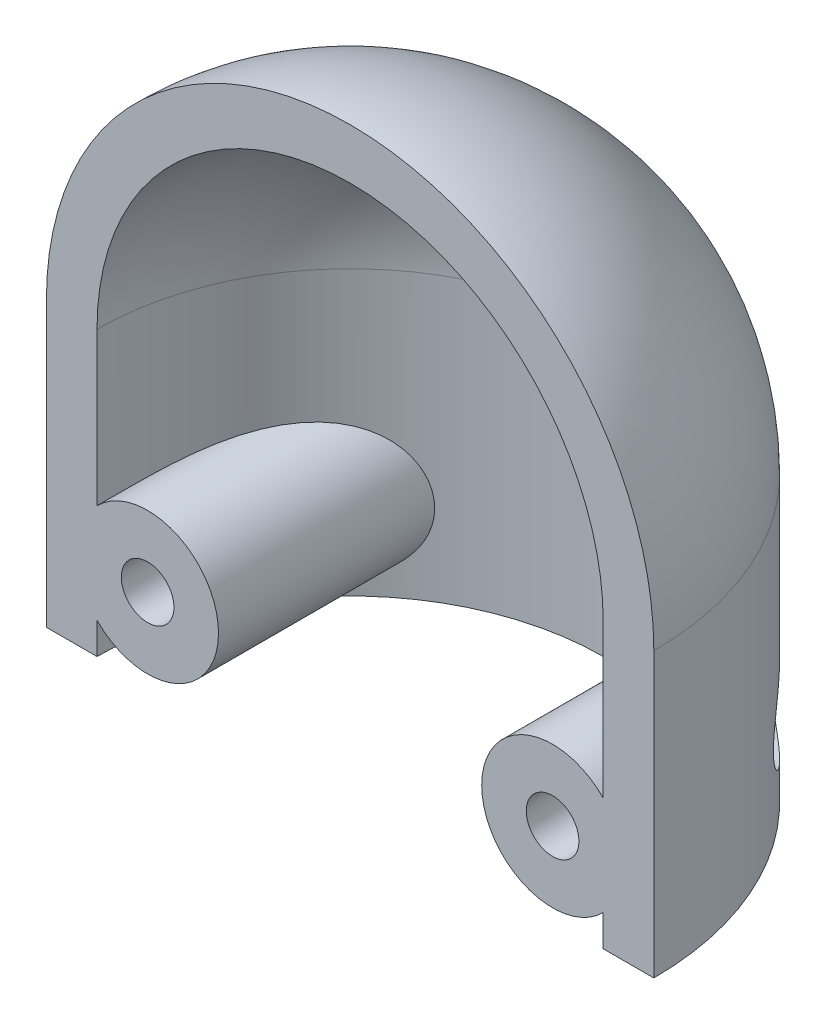
from build123d import *

# Parameters (mm, degrees)
ROTATION1_ANGLE                 = 180
AUFSATZ_LINEAR_AUSTRAGEN1_REACH = 35.945
SKIZZE2_R                       = 3.5
SKIZZE4_R                       = 1.3
SCHNITT_LINEAR_AUSTRAGEN1_DEPTH = 34.944808145
SCHNITT_LINEAR_START            = -2
SKIZZE5_R                       = 2.25
SCHNITT_LINEAR_AUSTRAGEN2_DEPTH = 32.944808233


with BuildPart() as part:
    # Skizze1 → Rotation1 (revolve)
    with BuildSketch(Plane.XY):
        with BuildLine():
            Line((0, 26.5), (0, 24))
            ThreePointArc((0, 24), (-8.838834765, 20.338834765), (-12.5, 11.5))
            Line((-12.5, 11.5), (-12.5, 3.158312395))
            Line((-12.5, 3.158312395), (-12.5, -0.158312395))
            Line((-12.5, -0.158312395), (-12.5, -2.5))
            Line((-12.5, -2.5), (-15, -2.5))
            Line((-15, -2.5), (-15, 11.5))
            ThreePointArc((-15, 11.5), (-10.606601718, 22.106601718), (0, 26.5))
        make_face()
    revolve(axis=Axis((0, 26.5, 0), (0, -1, 0)), revolution_arc=ROTATION1_ANGLE)

    # Skizze2 → Aufsatz-Linear austragen1 (add, up to next)
    with BuildSketch(Plane.XY, mode=Mode.PRIVATE) as aufsatz_linear_austragen1_sk1:
        with Locations((-10, 1.5)):
            Circle(SKIZZE2_R)
        with BuildLine():
            ThreePointArc((-12.5, -0.158312395), (-7, 1.5), (-12.5, 3.158312395))
            Line((-12.5, 3.158312395), (-12.5, -0.158312395))
        make_face(mode=Mode.SUBTRACT)
    aufsatz_linear_austragen1_tool1 = extrude(aufsatz_linear_austragen1_sk1.sketch, amount=-AUFSATZ_LINEAR_AUSTRAGEN1_REACH, mode=Mode.PRIVATE) - part.part
    # Skizze2 → Aufsatz-Linear austragen1 (add, up to next)
    with BuildSketch(Plane.XY, mode=Mode.PRIVATE) as aufsatz_linear_austragen1_sk2:
        with BuildLine():
            Line((-12.5, 3.158312395), (-12.5, -0.158312395))
            ThreePointArc((-12.5, -0.158312395), (-7, 1.5), (-12.5, 3.158312395))
        make_face()
    aufsatz_linear_austragen1_tool2 = extrude(aufsatz_linear_austragen1_sk2.sketch, amount=-AUFSATZ_LINEAR_AUSTRAGEN1_REACH, mode=Mode.PRIVATE) - part.part
    aufsatz_linear_austragen1_1 = aufsatz_linear_austragen1_tool1.solids().sort_by_distance((-13.401005, 1.5, 0))[0]
    add(aufsatz_linear_austragen1_1)
    aufsatz_linear_austragen1_2 = aufsatz_linear_austragen1_tool2.solids().sort_by_distance((-9.888016, 1.5, 0))[0]
    add(aufsatz_linear_austragen1_2)
    aufsatz_linear_austragen1 = aufsatz_linear_austragen1_1 + aufsatz_linear_austragen1_2  # Aufsatz-Linear austragen1 as one shape, for the pattern or mirror that repeats it

    # Skizze4 → Schnitt-Linear austragen1 (cut, through all)
    with BuildSketch(Plane.XY):
        with Locations((-10, 1.5)):
            Circle(SKIZZE4_R)
    schnitt_linear_austragen1 = extrude(amount=-SCHNITT_LINEAR_AUSTRAGEN1_DEPTH, mode=Mode.SUBTRACT)

    # Skizze5 → Schnitt-Linear austragen2 (cut, through all)
    with BuildSketch(Plane.XY.offset(SCHNITT_LINEAR_START)):
        with Locations((-10, 1.5)):
            Circle(SKIZZE5_R)
    schnitt_linear_austragen2 = extrude(amount=-SCHNITT_LINEAR_AUSTRAGEN2_DEPTH, mode=Mode.SUBTRACT)

    # Spiegeln1: Aufsatz-Linear austragen1, Schnitt-Linear austragen1, Schnitt-Linear austragen2 across plane
    add(aufsatz_linear_austragen1.mirror(Plane(origin=(0, 0, 0), x_dir=(0, 0, 1), z_dir=(1, 0, 0))))
    add(schnitt_linear_austragen1.mirror(Plane(origin=(0, 0, 0), x_dir=(0, 0, 1), z_dir=(1, 0, 0))), mode=Mode.SUBTRACT)
    add(schnitt_linear_austragen2.mirror(Plane(origin=(0, 0, 0), x_dir=(0, 0, 1), z_dir=(1, 0, 0))), mode=Mode.SUBTRACT)


solid = part.part
